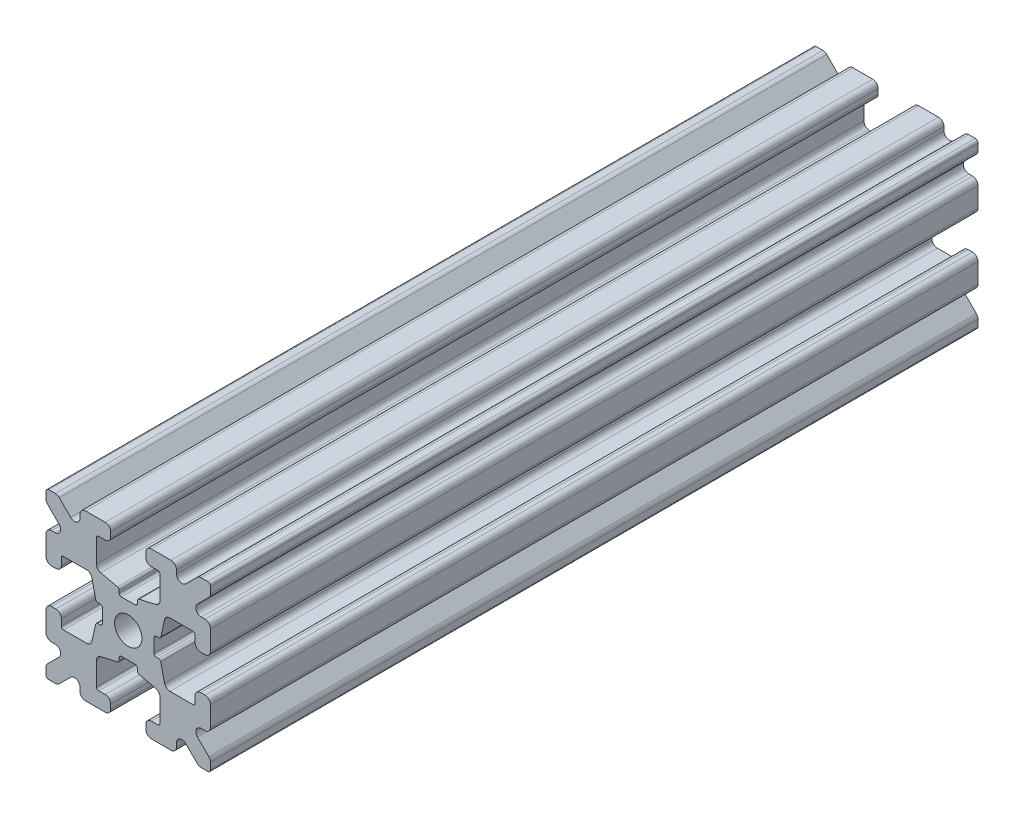
from build123d import *

# Parameters (mm, degrees)
SKETCH1_W           = 15
SKETCH1_H           = 15
SKETCH1_R           = 1.25
BOSS_EXTRUDE1_DEPTH = 35
FILLET1_R           = 0.25
CUT_EXTRUDE1_DEPTH  = 71.799011293
CUT_EXTRUDE3_DEPTH  = 71.799011293
FILLET3_R           = 0.5
FILLET4_R           = 0.5
FILLET5_R           = 3
FILLET6_R           = 0.2
CUT_EXTRUDE4_DEPTH  = 71.799011293
FILLET8_R           = 0.5
SKETCH6_W           = 5.1529354
SKETCH6_H           = 1.651
SKETCH6_W_2         = 1.651
SKETCH6_H_2         = 5.1529354
CUT_EXTRUDE5_DEPTH  = 71.799011293
FILLET10_R          = 0.2


with BuildPart() as part:
    # Sketch1 → Boss-Extrude1 (new, symmetric)
    with BuildSketch(Plane.XY):
        Rectangle(SKETCH1_W, SKETCH1_H)
        Circle(SKETCH1_R, mode=Mode.SUBTRACT)
    extrude(amount=BOSS_EXTRUDE1_DEPTH, both=True)

    # Fillet1
    fillet1_edges = [part.edges().sort_by_distance(p)[0] for p in [
        (7.5, -7.5, 0),
        (-7.5, -7.5, 0),
        (-7.5, 7.5, 0),
        (7.5, 7.5, 0),
    ]]
    fillet(fillet1_edges, radius=FILLET1_R)

    # Sketch2 → Cut-Extrude1 (cut, through all)
    with BuildSketch(Plane.XY.offset(35)):
        Polygon((-7.5, 1.6), (-6.1, 1.6), (-6.1, 2.9), (-3.4, 2.9), (-3.4, -2.9), (-6.1, -2.9), (-6.1, -1.6), (-7.5, -1.6), align=None)
        Polygon((2.9, 6.1), (1.6, 6.1), (1.6, 7.5), (-1.6, 7.5), (-1.6, 6.1), (-2.9, 6.1), (-2.9, 3.4), (2.9, 3.4), align=None)
        Polygon((-1.6, -7.5), (-1.6, -6.1), (-2.9, -6.1), (-2.9, -3.4), (2.9, -3.4), (2.9, -6.1), (1.6, -6.1), (1.6, -7.5), align=None)
        Polygon((6.1, -2.9), (6.1, -1.6), (7.5, -1.6), (7.5, 1.6), (6.1, 1.6), (6.1, 2.9), (3.4, 2.9), (3.4, -2.9), align=None)
    extrude(amount=-CUT_EXTRUDE1_DEPTH, mode=Mode.SUBTRACT)

    # Sketch4 → Cut-Extrude3 (cut, through all)
    with BuildSketch(Plane.XY.offset(35)):
        Polygon((-3.4, 2.9), (-2.75, 0), (-3.4, -2.9), align=None)
        Polygon((-2.9, 3.4), (0, 2.75), (2.9, 3.4), align=None)
        Polygon((3.4, 2.9), (2.75, 0), (3.4, -2.9), align=None)
        Polygon((-2.9, -3.4), (0, -2.75), (2.9, -3.4), align=None)
    extrude(amount=-CUT_EXTRUDE3_DEPTH, mode=Mode.SUBTRACT)

    # Fillet3
    fillet3_edges = [part.edges().sort_by_distance(p)[0] for p in [
        (1.6, -7.5, 0),
        (-1.6, -7.5, 0),
        (-1.6, -6.1, 0),
        (1.6, -6.1, 0),
        (6.1, 1.6, 0),
        (7.5, 1.6, 0),
        (7.5, -1.6, 0),
        (6.1, -1.6, 0),
        (-7.5, -1.6, 0),
        (-7.5, 1.6, 0),
        (-6.1, 1.6, 0),
        (-6.1, -1.6, 0),
        (-1.6, 6.1, 0),
        (-1.6, 7.5, 0),
        (1.6, 7.5, 0),
        (1.6, 6.1, 0),
    ]]
    fillet(fillet3_edges, radius=FILLET3_R)

    # Fillet4
    fillet4_edges = [part.edges().sort_by_distance(p)[0] for p in [
        (-2.9, -3.4, 0),
        (2.9, -3.4, 0),
        (3.4, -2.9, 0),
        (3.4, 2.9, 0),
        (-3.4, 2.9, 0),
        (-3.4, -2.9, 0),
        (2.9, 3.4, 0),
        (-2.9, 3.4, 0),
    ]]
    fillet(fillet4_edges, radius=FILLET4_R)

    # Fillet5
    fillet5_edges = [part.edges().sort_by_distance(p)[0] for p in [
        (-2.75, 0, 0),
        (0, 2.75, 0),
        (2.75, 0, 0),
        (0, -2.75, 0),
    ]]
    fillet(fillet5_edges, radius=FILLET5_R)

    # Fillet6
    fillet6_edges = [part.edges().sort_by_distance(p)[0] for p in [
        (-2.9, -6.1, 0),
        (2.9, -6.1, 0),
        (6.1, -2.9, 0),
        (6.1, 2.9, 0),
        (-6.1, 2.9, 0),
        (-6.1, -2.9, 0),
        (2.9, 6.1, 0),
        (-2.9, 6.1, 0),
    ]]
    fillet(fillet6_edges, radius=FILLET6_R)

    # Sketch5 → Cut-Extrude4 (cut, through all)
    with BuildSketch(Plane.XY.offset(35)):
        Polygon((-7.5, 6.439339828), (-5.460660172, 4.4), (-7.5, 4.4), align=None)
        Polygon((-6.439339828, 7.5), (-4.4, 5.460660172), (-4.4, 7.5), align=None)
        Polygon((4.4, 7.5), (6.439339828, 7.5), (4.4, 5.460660172), align=None)
        Polygon((7.5, 6.439339828), (7.5, 4.4), (5.460660172, 4.4), align=None)
        Polygon((7.5, -6.439339828), (5.460660172, -4.4), (7.5, -4.4), align=None)
        Polygon((6.439339828, -7.5), (4.4, -5.460660172), (4.4, -7.5), align=None)
        Polygon((-4.4, -7.5), (-6.439339828, -7.5), (-4.4, -5.460660172), align=None)
        Polygon((-7.5, -6.439339828), (-7.5, -4.4), (-5.460660172, -4.4), align=None)
    extrude(amount=-CUT_EXTRUDE4_DEPTH, mode=Mode.SUBTRACT)

    # Fillet8
    fillet8_edges = [part.edges().sort_by_distance(p)[0] for p in [
        (-7.5, 4.4, 0),
        (-7.5, 6.439339828, 0),
        (-5.460660172, 4.4, 0),
        (7.5, -4.4, 0),
        (7.5, -6.439339828, 0),
        (5.460660172, -4.4, 0),
        (5.460660172, 4.4, 0),
        (7.5, 6.439339828, 0),
        (7.5, 4.4, 0),
        (-4.4, 7.5, 0),
        (-4.4, 5.460660172, 0),
        (-6.439339828, 7.5, 0),
        (-5.460660172, -4.4, 0),
        (-7.5, -6.439339828, 0),
        (-7.5, -4.4, 0),
        (4.4, 5.460660172, 0),
        (4.4, 7.5, 0),
        (6.439339828, 7.5, 0),
        (6.439339828, -7.5, 0),
        (4.4, -7.5, 0),
        (4.4, -5.460660172, 0),
        (-6.439339828, -7.5, 0),
        (-4.4, -5.460660172, 0),
        (-4.4, -7.5, 0),
    ]]
    fillet(fillet8_edges, radius=FILLET8_R)

    # Sketch6 → Cut-Extrude5 (cut, through all)
    with BuildSketch(Plane.XY.offset(35)):
        with Locations((4.9235323, 0)):
            Rectangle(SKETCH6_W, SKETCH6_H)
        with Locations((0, -4.9235323)):
            Rectangle(SKETCH6_W_2, SKETCH6_H_2)
        with Locations((-4.9235323, 0)):
            Rectangle(SKETCH6_W, SKETCH6_H)
        with Locations((0, 4.9235323)):
            Rectangle(SKETCH6_W_2, SKETCH6_H_2)
    extrude(amount=-CUT_EXTRUDE5_DEPTH, mode=Mode.SUBTRACT)

    # Fillet10
    fillet10_edges = [part.edges().sort_by_distance(p)[0] for p in [
        (0.8255, -2.935025862, 0),
        (-0.8255, -2.935025862, 0),
        (0.8255, -2.3470646, 0),
        (-0.8255, -2.3470646, 0),
        (2.935025862, 0.8255, 0),
        (2.935025862, -0.8255, 0),
        (2.3470646, 0.8255, 0),
        (2.3470646, -0.8255, 0),
        (-2.935025862, -0.8255, 0),
        (-2.935025862, 0.8255, 0),
        (-2.3470646, -0.8255, 0),
        (-2.3470646, 0.8255, 0),
        (-0.8255, 2.935025862, 0),
        (0.8255, 2.935025862, 0),
        (-0.8255, 2.3470646, 0),
        (0.8255, 2.3470646, 0),
    ]]
    fillet(fillet10_edges, radius=FILLET10_R)


solid = part.part
